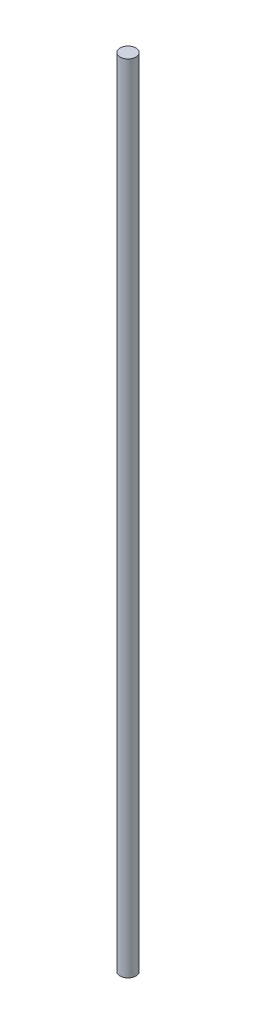
from build123d import *

# Parameters (mm, degrees)
SKETCH_1_R      = 1
EXTRUDE_1_DEPTH = 100


with BuildPart() as part:
    # ｽｹｯﾁ1 → ﾎﾞｽ - 押し出し1 (new body)
    with BuildSketch(Plane(origin=(0, 0, 0), x_dir=(1, 0, 0), z_dir=(0, 1, 0))):
        with Locations(Location((0, 0, 0), (0, 0, 270))):
            Circle(SKETCH_1_R)
    extrude(amount=EXTRUDE_1_DEPTH)


solid = part.part
